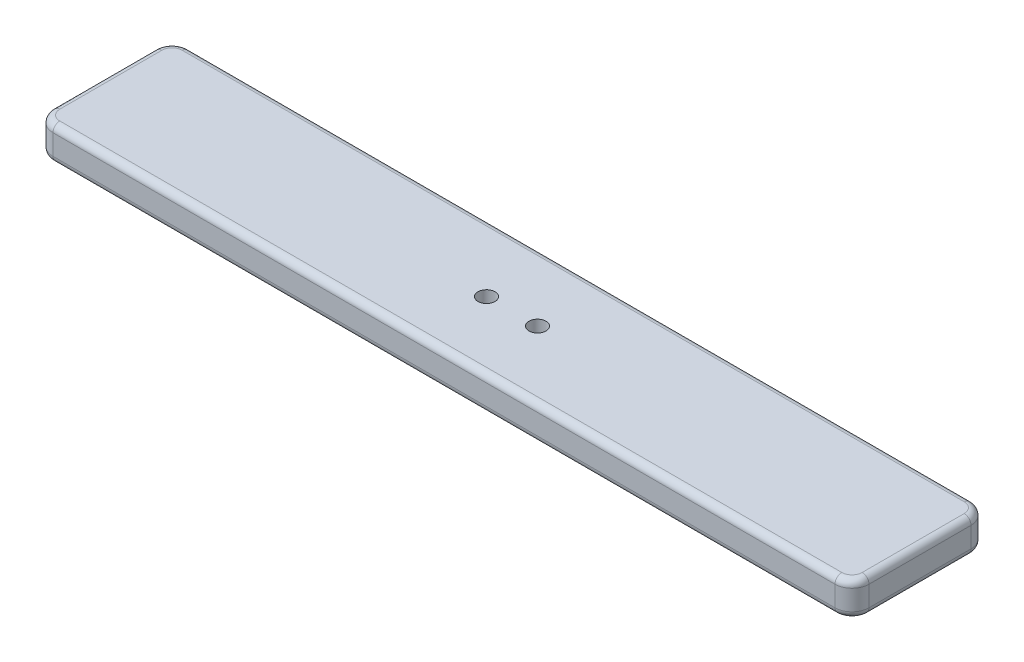
from build123d import *

# Parameters (mm, degrees)
SKETCH1_W           = 304.8
SKETCH1_H           = 50.8
BOSS_EXTRUDE1_DEPTH = 12.7
FILLET1_R           = 6.35
FILLET2_R           = 2.54
SKETCH2_R           = 3.175
CUT_EXTRUDE1_DEPTH  = 310.265209812


with BuildPart() as part:
    # Sketch1 → Boss-Extrude1 (new body)
    with BuildSketch(Plane(origin=(0, 0, 0), x_dir=(1, 0, 0), z_dir=(0, 1, 0))):
        with Locations((152.4, 25.4)):
            Rectangle(SKETCH1_W, SKETCH1_H)
    extrude(amount=BOSS_EXTRUDE1_DEPTH)

    # Fillet1
    fillet1_edges = [part.edges().sort_by_distance(p)[0] for p in [
        (0, 6.35, -50.8),
        (304.8, 6.35, -50.8),
        (304.8, 6.35, 0),
        (0, 6.35, 0),
    ]]
    fillet(fillet1_edges, radius=FILLET1_R)

    # Fillet2
    fillet2_edges = [part.edges().sort_by_distance(p)[0] for p in [
        (152.4, 0, -50.8),
        (152.4, 12.7, -50.8),
        (0, 0, -25.4),
        (304.8, 0, -25.4),
        (152.4, 0, 0),
        (1.859871939, 0, -1.859871939),
        (1.859871939, 0, -48.940128061),
        (302.940128061, 0, -1.859871939),
        (302.940128061, 0, -48.940128061),
        (304.8, 12.7, -25.4),
        (0, 12.7, -25.4),
        (152.4, 12.7, 0),
        (1.859871939, 12.7, -1.859871939),
        (1.859871939, 12.7, -48.940128061),
        (302.940128061, 12.7, -1.859871939),
        (302.940128061, 12.7, -48.940128061),
    ]]
    fillet(fillet2_edges, radius=FILLET2_R)

    # Sketch2 → Cut-Extrude1 (cut, through all)
    with BuildSketch(Plane(origin=(0, 12.7, 0), x_dir=(1, 0, 0), z_dir=(0, 1, 0))):
        with Locations(Location((142.875, 25.4, 0), (0, 0, 270))):
            Circle(SKETCH2_R)
        with Locations(Location((161.925, 25.4, 0), (0, 0, 90))):
            Circle(SKETCH2_R)
    extrude(amount=-CUT_EXTRUDE1_DEPTH, mode=Mode.SUBTRACT)


solid = part.part
